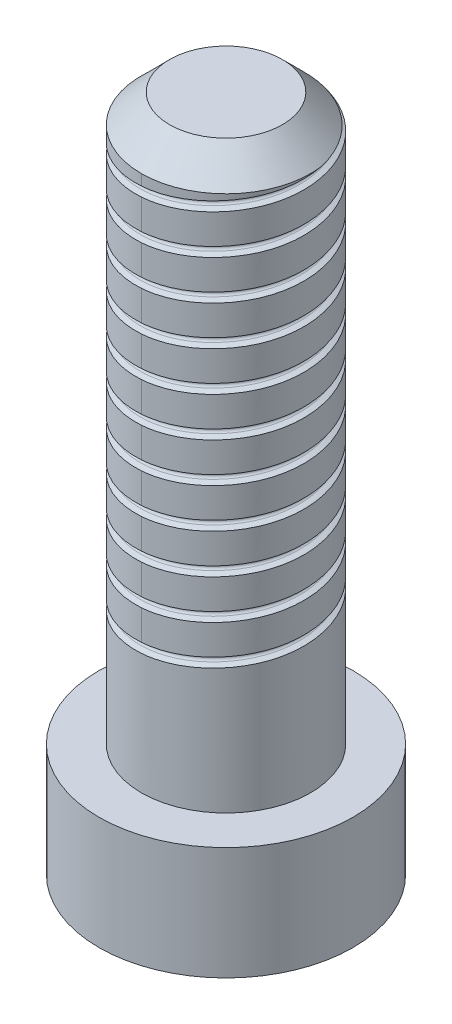
from build123d import *

# Parameters (mm, degrees)
SKETCH1_R              = 2.25
BOSS_EXTRUDE1_DEPTH    = 12
SKETCH2_OUTSIDE_W      = 9.216
SKETCH2_OUTSIDE_H      = 9.216
SKETCH2_OUTSIDE_R      = 1.5
CUT_EXTRUDE1_DEPTH     = 10
CHAMFER1_SIZE          = 0.5
CUT_SWEEP1_PITCH       = 0.7
CUT_SWEEP1_HEIGHT      = 8
CUT_SWEEP1_RADIUS      = 1.5
CUT_SWEEP1_START_ANGLE = 180
CUT_EXTRUDE2_DEPTH     = 1.5


with BuildPart() as part:
    # Sketch1 → Boss-Extrude1 (new body)
    with BuildSketch(Plane(origin=(0, 0, 0), x_dir=(1, 0, 0), z_dir=(0, 1, 0))):
        with Locations(Location((0, 0, 0), (0, 0, 270))):
            Circle(SKETCH1_R)
    extrude(amount=BOSS_EXTRUDE1_DEPTH)

    # Sketch2 outside → Cut-Extrude1 (cut)
    with BuildSketch(Plane(origin=(0, 12, 0), x_dir=(1, 0, 0), z_dir=(0, 1, 0))):
        Rectangle(SKETCH2_OUTSIDE_W, SKETCH2_OUTSIDE_H)
        with Locations(Location((0, 0, 0), (0, 0, 270))):
            Circle(SKETCH2_OUTSIDE_R, mode=Mode.SUBTRACT)
    extrude(amount=-CUT_EXTRUDE1_DEPTH, mode=Mode.SUBTRACT)

    # Chamfer1
    chamfer1_edges = [part.edges().sort_by_distance(p)[0] for p in [
        (0, 12, -1.5),
    ]]
    chamfer(chamfer1_edges, length=CHAMFER1_SIZE)

    # Cut-Sweep1: sweep along a helix
    with BuildLine() as cut_sweep1_path:
        add(Helix(CUT_SWEEP1_PITCH, CUT_SWEEP1_HEIGHT, CUT_SWEEP1_RADIUS, center=(0, 12, 0), direction=(0, -1, 0), mode=Mode.PRIVATE).rotate(Axis((0, 12, 0), (0, -1, 0)), CUT_SWEEP1_START_ANGLE))
    # Sketch7 → Cut-Sweep1 (sweep, cut)
    with BuildSketch(Plane(origin=(0, 12, 1.5), x_dir=(0, 0, 1), z_dir=(-0.9972531714167715, -0.07406829348102623, 0))):
        with BuildLine():
            Line((-0.081023547, -0.030253267), (0.549038106, 0.274742329))
            Line((0.549038106, 0.274742329), (0.549038106, -0.425257671))
            Line((0.549038106, -0.425257671), (-0.081023547, -0.120262075))
            ThreePointArc((-0.081023547, -0.120262075), (-0.109238147, -0.075257671), (-0.081023547, -0.030253267))
        make_face()
    sweep(path=cut_sweep1_path.line, is_frenet=True, mode=Mode.SUBTRACT)

    # Sketch8 → Cut-Extrude2 (cut)
    with BuildSketch(Plane.XZ):
        Polygon((1.154700538, 0), (0.577350269, 1), (-0.577350269, 1), (-1.154700538, 0), (-0.577350269, -1), (0.577350269, -1), align=None)
    extrude(amount=-CUT_EXTRUDE2_DEPTH, mode=Mode.SUBTRACT)


solid = part.part
